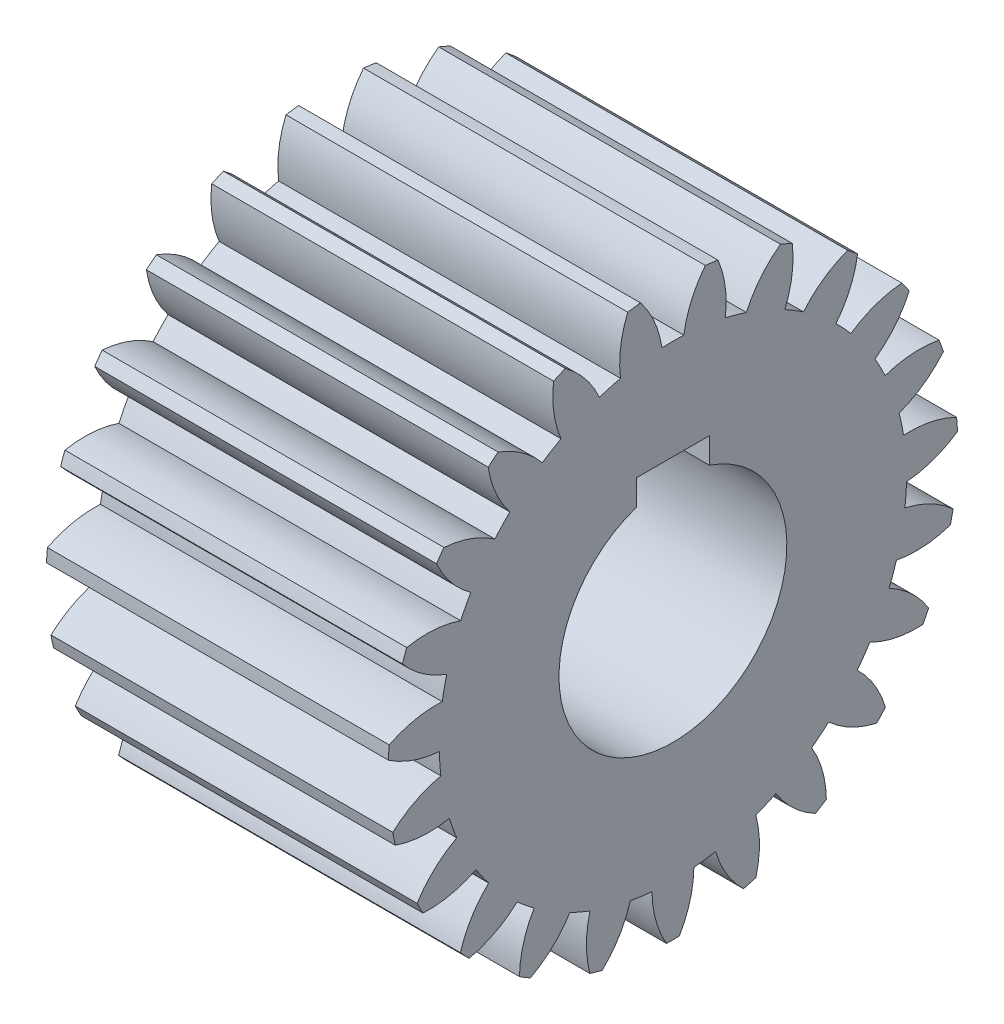
from build123d import *

# Parameters (mm, degrees)
BASPROSKE_W     = 75
BASPROSKE_H     = 62.5
TOOTHCUT_DEPTH  = 116.920231194
TEETHCUTS_COUNT = 23
TEETHCUTS_ANGLE = 344.347826087
BORSKE_R        = 25
BORE_DEPTH      = 75.0000508
KEYSKE_W        = 16
KEYSKE_H        = 29.3
KEYWAY_DEPTH    = 75.0000508


with BuildPart() as part:
    # BasProSke → Base-Revolve (revolve)
    with BuildSketch(Plane(origin=(0, 0, 0), x_dir=(1, 0, 0), z_dir=(0, 1, 0)), mode=Mode.PRIVATE) as base_revolve_sk:
        with Locations((37.5, 31.25)):
            Rectangle(BASPROSKE_W, BASPROSKE_H)
    revolve(base_revolve_sk.sketch.rotate(Axis((-10, 0, 0), (1, 0, 0)), 180), axis=Axis((-10, 0, 0), (1, 0, 0)))

    # TooCutSke → ToothCut (cut, through all)
    with BuildSketch(Plane(origin=(0, 0, 0), x_dir=(0, 0, -1), z_dir=(1, 0, 0))):
        with BuildLine():
            ThreePointArc((2.400061822, 51.192770039), (0, 51.249), (-2.400061822, 51.192770039))
            ThreePointArc((-2.400061822, 51.192770039), (-4.047924228, 56.96654952), (-7.134029469, 62.11707711))
            ThreePointArc((-7.134029469, 62.11707711), (0, 62.5254), (7.134029469, 62.11707711))
            ThreePointArc((7.134029469, 62.11707711), (4.047924228, 56.96654952), (2.400061822, 51.192770039))
        make_face()
    toothcut = extrude(amount=TOOTHCUT_DEPTH, mode=Mode.SUBTRACT)

    # TeethCuts: ToothCut ×23 about axis
    teethcuts_axis = Axis((-10, 0, 0), (1, 0, 0))
    for i in range(1, TEETHCUTS_COUNT):
        add(toothcut.rotate(teethcuts_axis, i * TEETHCUTS_ANGLE / (TEETHCUTS_COUNT - 1)), mode=Mode.SUBTRACT)

    # BorSke → Bore (cut, symmetric)
    with BuildSketch(Plane(origin=(0, 0, 0), x_dir=(0, 0, -1), z_dir=(1, 0, 0))):
        with Locations(Location((0, 0, 0), (0, 0, 180))):
            Circle(BORSKE_R)
    extrude(amount=BORE_DEPTH, both=True, mode=Mode.SUBTRACT)

    # KeySke → Keyway (cut, symmetric)
    with BuildSketch(Plane(origin=(0, 0, 0), x_dir=(0, 0, -1), z_dir=(1, 0, 0))):
        with Locations((0, 14.65)):
            Rectangle(KEYSKE_W, KEYSKE_H)
    extrude(amount=KEYWAY_DEPTH, both=True, mode=Mode.SUBTRACT)


solid = part.part
